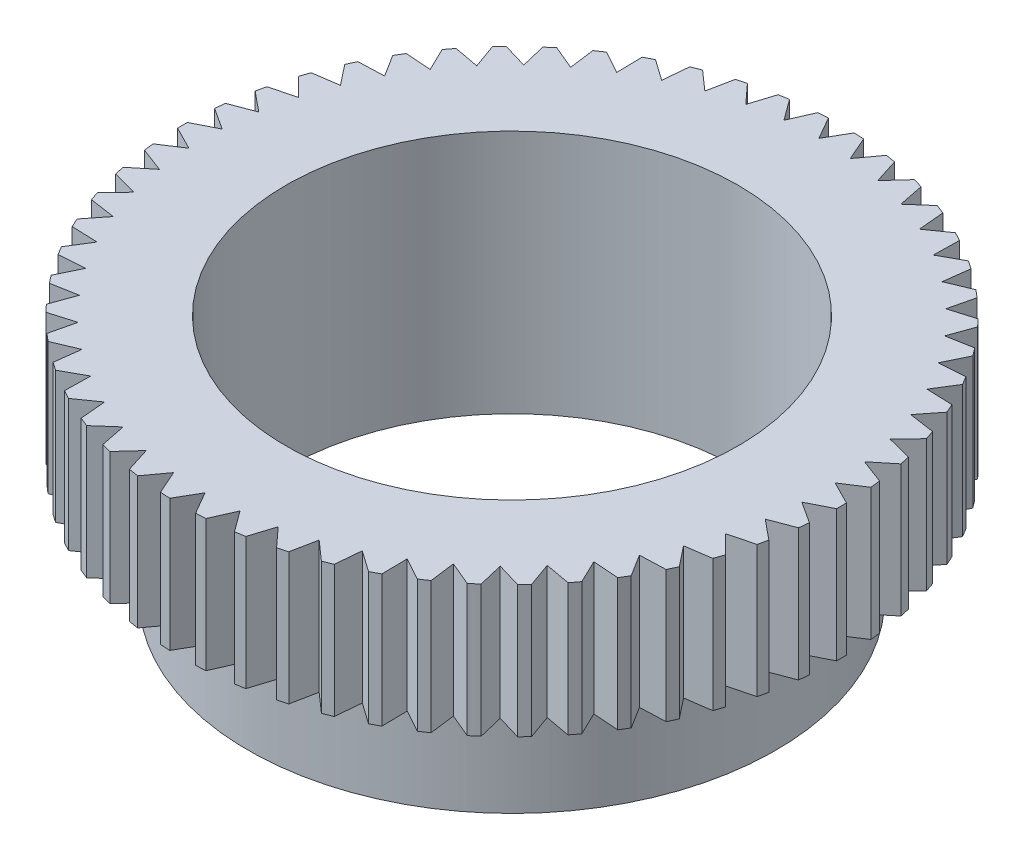
from build123d import *

# Parameters (mm, degrees)
ENL_V_MAT_EXTRU_1_REACH      = 15.978
R_P_TITION_CIRCULAIRE1_COUNT = 58


with BuildPart() as part:
    # Esquisse1 → Révolution1 (revolve)
    with BuildSketch(Plane.XY, mode=Mode.PRIVATE) as r_volution1_sk:
        Polygon((-6, 0), (-6, 6.5), (-8.75, 6.5), (-8.75, 3), (-7, 3), (-7, 0), align=None)
    revolve(r_volution1_sk.sketch.rotate(Axis((0, -0.732411219, 0), (0, 1, 0)), 270), axis=Axis((0, -0.732411219, 0), (0, 1, 0)))

    # Esquisse2 → Enlèv. mat.-Extru.1 (cut, up to next)
    with BuildSketch(Plane(origin=(0, 6.5, 0), x_dir=(1, 0, 0), z_dir=(0, 1, 0)), mode=Mode.PRIVATE) as enl_v_mat_extru_1_sk1:
        Polygon((0, 8.15), (0.346410162, 8.75), (-0.346410162, 8.75), align=None)
    enl_v_mat_extru_1_tool1 = extrude(enl_v_mat_extru_1_sk1.sketch, amount=-ENL_V_MAT_EXTRU_1_REACH, mode=Mode.PRIVATE) & part.part
    enl_v_mat_extru_1 = enl_v_mat_extru_1_tool1.solids().sort_by_distance((0, 6.5, -8.55))[0]
    add(enl_v_mat_extru_1, mode=Mode.SUBTRACT)

    # Répétition circulaire1: Enlèv. mat.-Extru.1 ×58 about axis
    r_p_tition_circulaire1_axis = Axis((0, 0, 0), (0, 1, 0))
    for i in range(1, R_P_TITION_CIRCULAIRE1_COUNT):
        add(enl_v_mat_extru_1.rotate(r_p_tition_circulaire1_axis, i * 360 / R_P_TITION_CIRCULAIRE1_COUNT), mode=Mode.SUBTRACT)


solid = part.part
